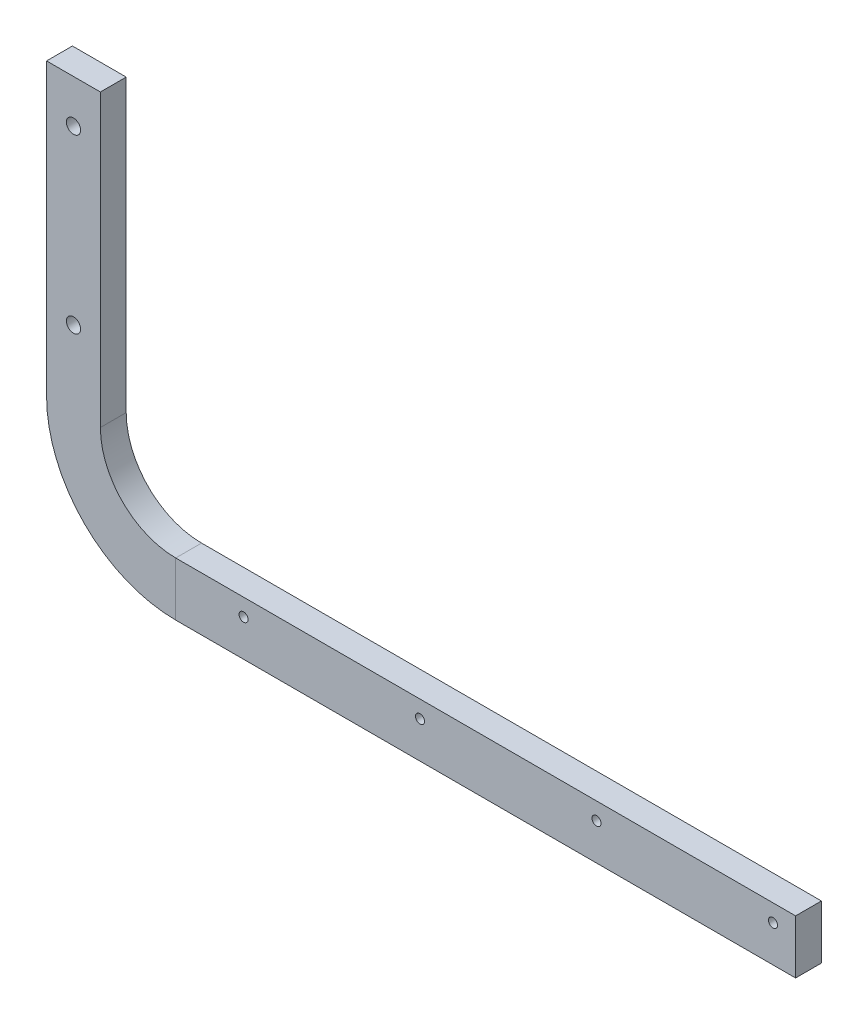
from build123d import *

# Parameters (mm, degrees)
BOSS_EXTRUDE1_DEPTH  = 6
M6_CLEARANCE_HOLE1_D = 6.6
M5_TAPPED_HOLE1_D    = 4.2
LPATTERN1_COUNT      = 4
LPATTERN1_PITCH      = 82


with BuildPart() as part:
    # Sketch1 → Boss-Extrude1 (new, symmetric)
    with BuildSketch(Plane.XY):
        with BuildLine():
            Line((0, 0), (0, -135))
            ThreePointArc((0, -135), (17.573593129, -177.426406871), (60, -195))
            Line((60, -195), (348, -195))
            Line((348, -195), (348, -170))
            Line((348, -170), (60, -170))
            ThreePointArc((60, -170), (35.251262658, -159.748737342), (25, -135))
            Line((25, -135), (25, 0))
            Line((25, 0), (0, 0))
        make_face()
    extrude(amount=BOSS_EXTRUDE1_DEPTH, both=True)

    # M6 Clearance Hole1 (through all)
    with Locations(Plane.XY.offset(6)):
        with Locations((12.5, -20), (12.5, -100)):
            Hole(M6_CLEARANCE_HOLE1_D / 2)

    # M5 Tapped Hole1 (through all)
    with Locations(Plane.XY.offset(6)):
        with Locations((337.5, -178)):
            m5_tapped_hole1 = Hole(M5_TAPPED_HOLE1_D / 2)

    # LPattern1: M5 Tapped Hole1 ×4
    with Locations(*[(-i * LPATTERN1_PITCH, 0, 0) for i in range(1, LPATTERN1_COUNT)]):
        add(m5_tapped_hole1, mode=Mode.SUBTRACT)


solid = part.part
